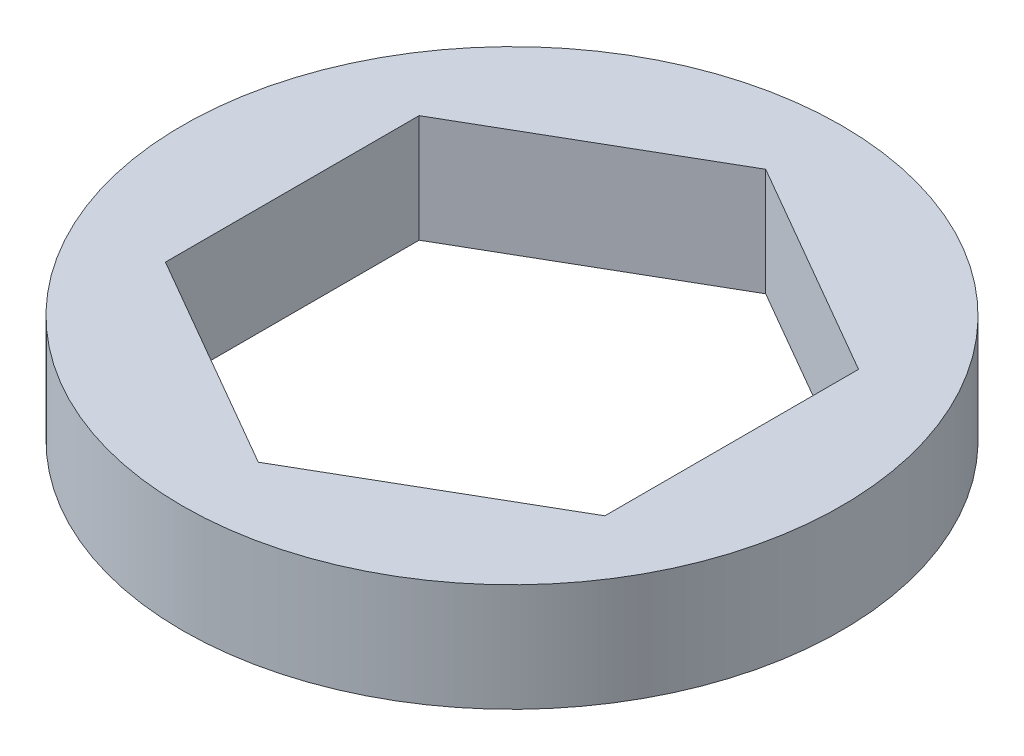
from build123d import *

# Parameters (mm, degrees)
SKETCH1_R           = 9.525
BOSS_EXTRUDE1_DEPTH = 3.11785


with BuildPart() as part:
    # Sketch1 → Boss-Extrude1 (new body)
    with BuildSketch(Plane(origin=(0, 0, 0), x_dir=(1, 0, 0), z_dir=(0, 1, 0))):
        with Locations(Location((0, 0, 0), (0, 0, 270))):
            Circle(SKETCH1_R)
        Polygon((0, 7.332348419), (-6.35, 3.666174209), (-6.35, -3.666174209), (0, -7.332348419), (6.35, -3.666174209), (6.35, 3.666174209), align=None, mode=Mode.SUBTRACT)
    extrude(amount=BOSS_EXTRUDE1_DEPTH)


solid = part.part
